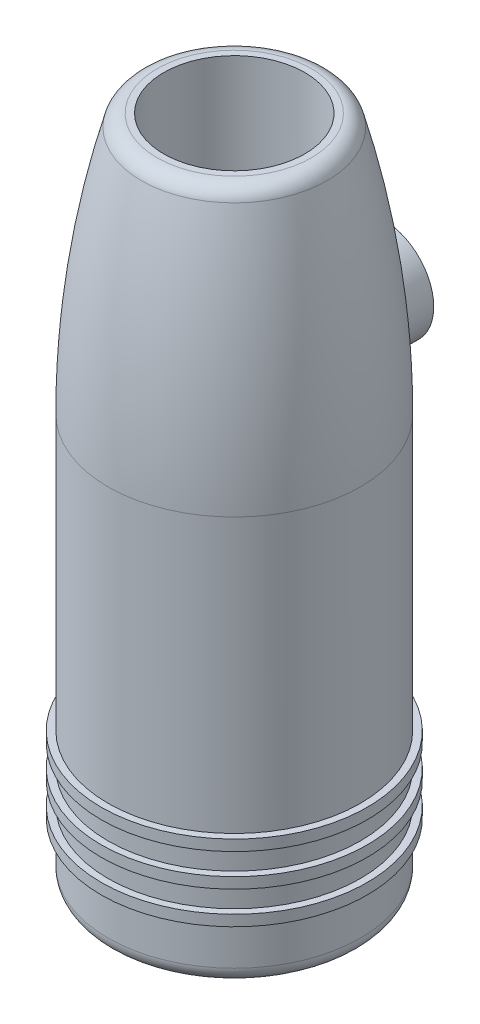
from build123d import *

# Parameters (mm, degrees)
ESQUISSE2_R             = 2.5
ENL_V_MAT_EXTRU_1_DEPTH = 128.786932135
BOSS_EXTRU_1_REACH      = 137.769
ESQUISSE3_R             = 9.25
CONG_1_R                = 1
TROU_TARAUD_M81_D       = 6.8
TROU_TARAUD_M81_DEPTH   = 22.25
TROU_TARAUD_M81_TIP     = 2.042926105
CONG_2_R                = 3
CONG_3_R                = 3
ESQUISSE6_R             = 3.85
ENL_V_MAT_EXTRU_2_DEPTH = 135.163230897


with BuildPart() as part:
    # Esquisse1 → Révolution1 (revolve)
    with BuildSketch(Plane.XY, mode=Mode.PRIVATE) as r_volution1_sk:
        with BuildLine():
            Line((23.25, 0), (23.25, 10.5))
            Line((23.25, 10.5), (24.5, 10.5))
            Line((24.5, 10.5), (24.5, 12.5))
            Line((24.5, 12.5), (23.25, 12.5))
            Line((23.25, 12.5), (23.25, 16.5))
            Line((23.25, 16.5), (24.5, 16.5))
            Line((24.5, 16.5), (24.5, 18.5))
            Line((24.5, 18.5), (23.25, 18.5))
            Line((23.25, 18.5), (23.25, 22.5))
            Line((23.25, 22.5), (24.5, 22.5))
            Line((24.5, 22.5), (24.5, 24.5))
            Line((24.5, 24.5), (23.25, 24.5))
            Line((23.25, 24.5), (23.25, 75))
            ThreePointArc((23.25, 75), (21.554238742, 99.236142948), (16.5, 123))
            Line((16.5, 123), (13, 123))
            Line((13, 123), (13, 50))
            Line((13, 50), (19, 50))
            Line((19, 50), (19, 0))
            Line((19, 0), (23.25, 0))
        make_face()
    revolve(r_volution1_sk.sketch.rotate(Axis((0, 0, 0), (0, 1, 0)), 90), axis=Axis((0, 0, 0), (0, 1, 0)))

    # Esquisse2 → Enlèv. mat.-Extru.1 (cut, through all)
    with BuildSketch(Plane.XY):
        with Locations(Location((0, 33, 0), (0, 0, 90))):
            Circle(ESQUISSE2_R)
    extrude(amount=-ENL_V_MAT_EXTRU_1_DEPTH, mode=Mode.SUBTRACT)

    # Esquisse3 → Boss.-Extru.1 (add, up to next)
    with BuildSketch(Plane.XY.offset(-27.5), mode=Mode.PRIVATE) as boss_extru_1_sk1:
        with Locations(Location((0, 83, 0), (0, 0, 239.867278169))):
            Circle(ESQUISSE3_R)
    boss_extru_1_tool1 = extrude(boss_extru_1_sk1.sketch, amount=BOSS_EXTRU_1_REACH, mode=Mode.PRIVATE) - part.part
    add(boss_extru_1_tool1.solids().sort_by_distance((0, 83, -27.5))[0])

    # Congé1
    cong_1_edges = [part.edges().sort_by_distance(p)[0] for p in [
        (-2.414282864, 74.070624974, -23.124310546),
        (8.941696454, 85.36824064, -21.126535612),
    ]]
    fillet(cong_1_edges, radius=CONG_1_R)

    # Trou taraudé M81
    with Locations(Plane(origin=(0, 0, -27.5), x_dir=(-1, 0, 0), z_dir=(0, 0, -1))):
        with Locations((0, 83)):
            Hole(TROU_TARAUD_M81_D / 2, depth=TROU_TARAUD_M81_DEPTH)
            with Locations((0, 0, -(TROU_TARAUD_M81_DEPTH + TROU_TARAUD_M81_TIP / 2))):  # 118° drill point
                Cone(0, TROU_TARAUD_M81_D / 2, TROU_TARAUD_M81_TIP, mode=Mode.SUBTRACT)

    # Congé2
    cong_2_edges = [part.edges().sort_by_distance(p)[0] for p in [
        (0, 0, 23.25),
    ]]
    fillet(cong_2_edges, radius=CONG_2_R)

    # Congé3
    cong_3_edges = [part.edges().sort_by_distance(p)[0] for p in [
        (0, 123, 16.5),
    ]]
    fillet(cong_3_edges, radius=CONG_3_R)

    # Esquisse6 → Enlèv. mat.-Extru.2 (cut, through all)
    with BuildSketch(Plane.XY.offset(-23.15)):
        with Locations((0, 33)):
            Circle(ESQUISSE6_R)
    extrude(amount=-ENL_V_MAT_EXTRU_2_DEPTH, mode=Mode.SUBTRACT)


solid = part.part
